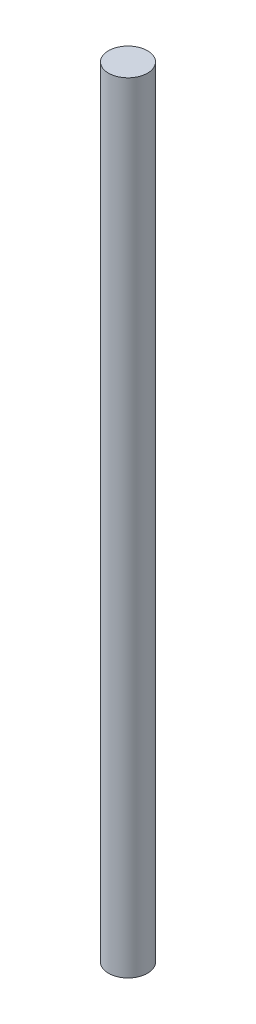
from build123d import *

# Parameters (mm, degrees)
SKETCH1_R           = 3
BOSS_EXTRUDE1_DEPTH = 120


with BuildPart() as part:
    # Sketch1 → Boss-Extrude1 (new body)
    with BuildSketch(Plane(origin=(0, 0, 0), x_dir=(1, 0, 0), z_dir=(0, 1, 0))):
        with Locations(Location((-5.326822835, 0, 0), (0, 0, 270))):
            Circle(SKETCH1_R)
    extrude(amount=BOSS_EXTRUDE1_DEPTH)


solid = part.part
